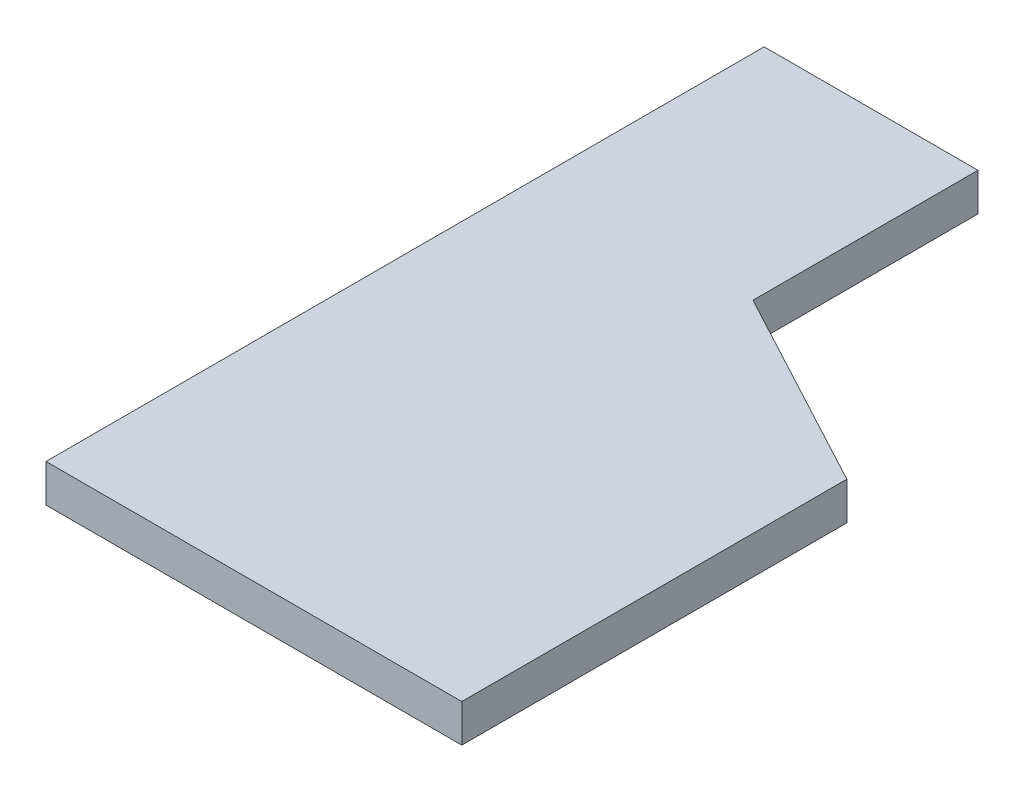
from build123d import *

# Parameters (mm, degrees)
SKETCH1_W           = 69.85
SKETCH1_H           = 6.35
BOSS_EXTRUDE1_DEPTH = 120.65
CUT_EXTRUDE1_DEPTH  = 140.555607197


with BuildPart() as part:
    # Sketch1 → Boss-Extrude1 (new body)
    with BuildSketch(Plane.XY):
        with Locations((34.925, 3.175)):
            Rectangle(SKETCH1_W, SKETCH1_H)
    extrude(amount=BOSS_EXTRUDE1_DEPTH)

    # Sketch2 → Cut-Extrude1 (cut, through all)
    with BuildSketch(Plane(origin=(0, 6.35, 0), x_dir=(1, 0, 0), z_dir=(0, 1, 0))):
        Polygon((35.923749516, 0), (35.923749516, -37.802999389), (69.85, -55.962276793), (69.85, 0), align=None)
    extrude(amount=-CUT_EXTRUDE1_DEPTH, mode=Mode.SUBTRACT)


solid = part.part
